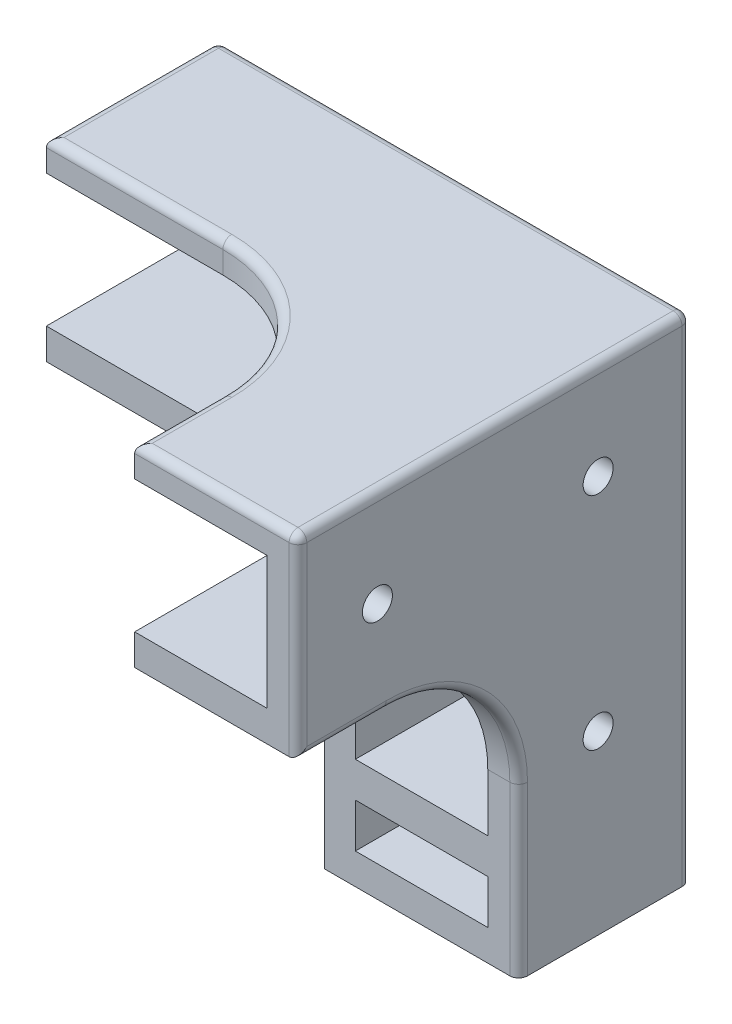
from build123d import *

# Parameters (mm, degrees)
BOSS_EXTRUDE1_DEPTH = 19.5
SKETCH3_W           = 18.5
SKETCH3_H           = 22
BOSS_EXTRUDE2_DEPTH = 25
SKETCH5_W           = 50
SKETCH5_H           = 15
SKETCH5_W_2         = 15
SKETCH5_H_2         = 5
CUT_EXTRUDE1_DEPTH  = 40.5
BOSS_EXTRUDE4_DEPTH = 3.5
BOSS_EXTRUDE5_DEPTH = 3.5
BOSS_EXTRUDE6_DEPTH = 3.5
FILLET3_R           = 3
SKETCH12_R          = 1.7
CUT_EXTRUDE4_DEPTH  = 5
SKETCH13_R          = 1.7
CUT_EXTRUDE5_DEPTH  = 45
SKETCH14_R          = 1.7
CUT_EXTRUDE6_DEPTH  = 45
SKETCH15_R          = 1.7
CUT_EXTRUDE7_DEPTH  = 4
FILLET4_R           = 1


with BuildPart() as part:
    # Sketch1 → Boss-Extrude1 (new body)
    with BuildSketch(Plane.XY):
        Polygon((-5.699410772, 32.916253451), (16.300589228, 32.916253451), (16.300589228, -23.083746549), (-5.699410772, -23.083746549), (-5.699410772, 10.916253451), (-37.199410772, 10.916253451), (-37.199410772, 32.916253451), align=None)
    extrude(amount=BOSS_EXTRUDE1_DEPTH)

    # Sketch3 → Boss-Extrude2 (add)
    with BuildSketch(Plane.XY.offset(19.5)):
        with Locations((7.050589228, 21.916253451)):
            Rectangle(SKETCH3_W, SKETCH3_H)
    extrude(amount=BOSS_EXTRUDE2_DEPTH)

    # Sketch5 → Cut-Extrude1 (cut)
    with BuildSketch(Plane.XY.offset(44.5)):
        with Locations((-12.199410772, 21.916253451)):
            Rectangle(SKETCH5_W, SKETCH5_H)
        with Locations((5.300589228, -3.083746549)):
            Rectangle(SKETCH5_W_2, SKETCH5_H)
        with Locations((5.300589228, -17.083746549)):
            Rectangle(SKETCH5_W_2, SKETCH5_H_2)
    extrude(amount=-CUT_EXTRUDE1_DEPTH, mode=Mode.SUBTRACT)

    # Sketch7 → Boss-Extrude4 (add)
    with BuildSketch(Plane(origin=(16.300589228, 0, 0), x_dir=(0, 0, -1), z_dir=(1, 0, 0))):
        with BuildLine():
            Line((-34.5, 10.916253451), (-19.5, 10.916253451))
            Line((-19.5, 10.916253451), (-19.5, -4.083746549))
            ThreePointArc((-19.5, -4.083746549), (-23.893398282, 6.522855169), (-34.5, 10.916253451))
        make_face()
    extrude(amount=-BOSS_EXTRUDE4_DEPTH)

    # Sketch8 → Boss-Extrude5 (add)
    with BuildSketch(Plane(origin=(0, 0, 0), x_dir=(-1, 0, 0), z_dir=(0, 0, -1))):
        with BuildLine():
            Line((5.699410772, 10.916253451), (20.699410772, 10.916253451))
            ThreePointArc((20.699410772, 10.916253451), (10.092809055, 6.522855169), (5.699410772, -4.083746549))
            Line((5.699410772, -4.083746549), (5.699410772, 10.916253451))
        make_face()
    extrude(amount=-BOSS_EXTRUDE5_DEPTH)

    # Sketch9 → Boss-Extrude6 (add)
    with BuildSketch(Plane(origin=(0, 32.916253451, 0), x_dir=(1, 0, 0), z_dir=(0, 1, 0))):
        with BuildLine():
            Line((-2.199410772, -34.5), (-2.199410772, -19.5))
            Line((-2.199410772, -19.5), (-17.199410772, -19.5))
            ThreePointArc((-17.199410772, -19.5), (-6.592809055, -23.893398282), (-2.199410772, -34.5))
        make_face()
    extrude(amount=-BOSS_EXTRUDE6_DEPTH)

    # Fillet3
    fillet3_edges = [part.edges().sort_by_distance(p)[0] for p in [
        (-2.199410772, 12.666253451, 19.5),
    ]]
    fillet(fillet3_edges, radius=FILLET3_R)

    # Sketch12 → Cut-Extrude4 (cut)
    with BuildSketch(Plane(origin=(0, 0, 0), x_dir=(-1, 0, 0), z_dir=(0, 0, -1))):
        with Locations((-5.300589228, 21.916253451)):
            Circle(SKETCH12_R)
        with Locations((10.949410772, 21.916253451)):
            Circle(SKETCH12_R)
        with Locations((27.199410772, 21.916253451)):
            Circle(SKETCH12_R)
    extrude(amount=-CUT_EXTRUDE4_DEPTH, mode=Mode.SUBTRACT)

    # Sketch13 → Cut-Extrude5 (cut)
    with BuildSketch(Plane.ZY.offset(5.699410772)):
        with Locations(Location((10.5, -3.083746549, 0), (0, 0, 270))):
            Circle(SKETCH13_R)
    extrude(amount=-CUT_EXTRUDE5_DEPTH, mode=Mode.SUBTRACT)

    # Sketch14 → Cut-Extrude6 (cut)
    with BuildSketch(Plane(origin=(16.300589228, 0, 0), x_dir=(0, 0, -1), z_dir=(1, 0, 0))):
        with Locations(Location((-10.5, 21.916253451, 0), (0, 0, 90))):
            Circle(SKETCH14_R)
        with Locations(Location((-35.5, 21.916253451, 0), (0, 0, 90))):
            Circle(SKETCH14_R)
    extrude(amount=-CUT_EXTRUDE6_DEPTH, mode=Mode.SUBTRACT)

    # Sketch15 → Cut-Extrude7 (cut)
    with BuildSketch(Plane.XZ.offset(23.083746549)):
        with Locations(Location((5.300589228, 9.75, 0), (0, 0, 270))):
            Circle(SKETCH15_R)
    extrude(amount=-CUT_EXTRUDE7_DEPTH, mode=Mode.SUBTRACT)

    # Fillet4
    fillet4_edges = [part.edges().sort_by_distance(p)[0] for p in [
        (-5.699410772, -13.583746549, 0),
        (-10.092809055, 6.522855169, 0),
        (-27.199410772, 32.916253451, 19.5),
        (-6.592809055, 32.916253451, 23.893398282),
        (16.300589228, 32.916253451, 22.25),
        (-37.199410772, 32.916253451, 9.75),
        (16.300589228, -13.583746549, 19.5),
        (16.300589228, 10.916253451, 39.5),
        (-2.199410772, 32.916253451, 39.5),
        (16.300589228, 21.916253451, 44.5),
        (7.050589228, 32.916253451, 44.5),
        (-10.449410772, 32.916253451, 0),
        (16.300589228, 4.916253451, 0),
        (-28.949410772, 10.916253451, 0),
        (-37.199410772, 21.916253451, 0),
        (16.300589228, 6.522855169, 23.893398282),
    ]]
    fillet(fillet4_edges, radius=FILLET4_R)


solid = part.part
